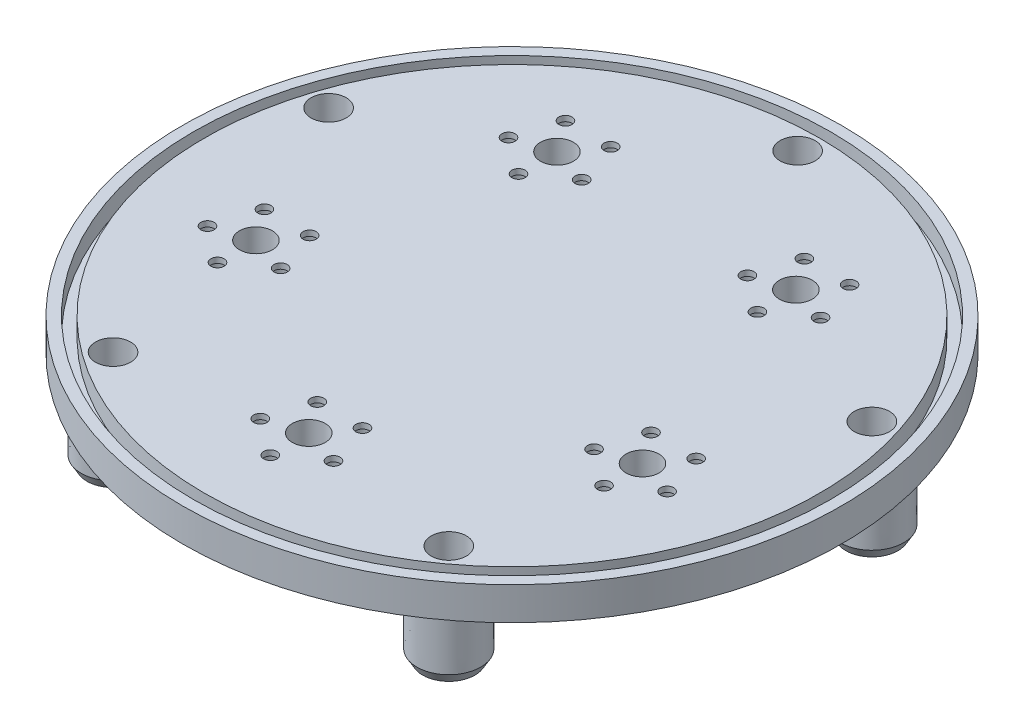
from build123d import *
from OCP.BRepFilletAPI import BRepFilletAPI_MakeChamfer

# Parameters (mm, degrees)
SKETCH1_R                     = 30
BOSS_EXTRUDE1_DEPTH           = 3
SKETCH5_R                     = 2.94
BOSS_EXTRUDE3_DEPTH           = 6
BOSS_EXTRUDE3_DRAFT           = 0.4
BOSS_EXTRUDE3_PROFILE_2_DEPTH = 6
BOSS_EXTRUDE3_PROFILE_2_DRAFT = 0.4
BOSS_EXTRUDE3_PROFILE_3_DEPTH = 6
BOSS_EXTRUDE3_PROFILE_3_DRAFT = 0.4
BOSS_EXTRUDE3_PROFILE_4_DEPTH = 6
BOSS_EXTRUDE3_PROFILE_4_DRAFT = 0.4
BOSS_EXTRUDE3_PROFILE_5_DEPTH = 6
BOSS_EXTRUDE3_PROFILE_5_DRAFT = 0.4
SKETCH6_R                     = 1.5
SKETCH6_R_2                   = 0.6
CUT_EXTRUDE2_DEPTH            = 43.848570571
SKETCH7_R                     = 1
CUT_EXTRUDE3_DEPTH            = 2.5
CUT_EXTRUDE4_DEPTH            = 1.7
SKETCH9_R                     = 1.6
CUT_EXTRUDE5_DEPTH            = 44.370496884
CHAMFER1_SIZE                 = 0.9
CHAMFER1_SIZE2                = 0.521730862
SKETCH2_R                     = 29
SKETCH2_R_2                   = 28
CUT_EXTRUDE6_DEPTH            = 1.7


with BuildPart() as part:
    # Sketch1 → Boss-Extrude1 (new body)
    with BuildSketch(Plane(origin=(0, 0, 0), x_dir=(1, 0, 0), z_dir=(0, 1, 0))):
        with Locations(Location((0, 0, 0), (0, 0, 270))):
            Circle(SKETCH1_R)
    extrude(amount=BOSS_EXTRUDE1_DEPTH)


with BuildPart() as boss_extrude3_tool:
    # Sketch5 → Boss-Extrude3 (with draft: the straight prism first)
    with BuildSketch(Plane.XZ):
        with Locations((0, -26)):
            Circle(SKETCH5_R)
    extrude(amount=BOSS_EXTRUDE3_DEPTH)
    # Boss-Extrude3: the draft: its side faces are tilted about the plane it starts from
    boss_extrude3_sides = [boss_extrude3_tool.faces().sort_by_distance(p)[0] for p in [
        (-2.94, -3, -26),
    ]]
    draft(boss_extrude3_sides, Plane.XZ, BOSS_EXTRUDE3_DRAFT)


with BuildPart() as part_1:
    add(part.part)

    # Boss-Extrude3: add boss_extrude3_tool
    add(boss_extrude3_tool.part)


with BuildPart() as boss_extrude3_profile_2_tool:
    # Sketch5 → Boss-Extrude3 profile 2 (with draft: the straight prism first)
    with BuildSketch(Plane.XZ):
        with Locations((-24.727469424, -8.034441854)):
            Circle(SKETCH5_R)
    extrude(amount=BOSS_EXTRUDE3_PROFILE_2_DEPTH)
    # Boss-Extrude3 profile 2: the draft: its side faces are tilted about the plane it starts from
    boss_extrude3_profile_2_sides = [boss_extrude3_profile_2_tool.faces().sort_by_distance(p)[0] for p in [
        (-27.667469424, -3, -8.034441854),
    ]]
    draft(boss_extrude3_profile_2_sides, Plane.XZ, BOSS_EXTRUDE3_PROFILE_2_DRAFT)


with BuildPart() as part_2:
    add(part_1.part)

    # Boss-Extrude3 profile 2: add boss_extrude3_profile_2_tool
    add(boss_extrude3_profile_2_tool.part)


with BuildPart() as boss_extrude3_profile_3_tool:
    # Sketch5 → Boss-Extrude3 profile 3 (with draft: the straight prism first)
    with BuildSketch(Plane.XZ):
        with Locations((-15.28241656, 21.034441854)):
            Circle(SKETCH5_R)
    extrude(amount=BOSS_EXTRUDE3_PROFILE_3_DEPTH)
    # Boss-Extrude3 profile 3: the draft: its side faces are tilted about the plane it starts from
    boss_extrude3_profile_3_sides = [boss_extrude3_profile_3_tool.faces().sort_by_distance(p)[0] for p in [
        (-18.22241656, -3, 21.034441854),
    ]]
    draft(boss_extrude3_profile_3_sides, Plane.XZ, BOSS_EXTRUDE3_PROFILE_3_DRAFT)


with BuildPart() as part_3:
    add(part_2.part)

    # Boss-Extrude3 profile 3: add boss_extrude3_profile_3_tool
    add(boss_extrude3_profile_3_tool.part)


with BuildPart() as boss_extrude3_profile_4_tool:
    # Sketch5 → Boss-Extrude3 profile 4 (with draft: the straight prism first)
    with BuildSketch(Plane.XZ):
        with Locations((15.28241656, 21.034441854)):
            Circle(SKETCH5_R)
    extrude(amount=BOSS_EXTRUDE3_PROFILE_4_DEPTH)
    # Boss-Extrude3 profile 4: the draft: its side faces are tilted about the plane it starts from
    boss_extrude3_profile_4_sides = [boss_extrude3_profile_4_tool.faces().sort_by_distance(p)[0] for p in [
        (12.34241656, -3, 21.034441854),
    ]]
    draft(boss_extrude3_profile_4_sides, Plane.XZ, BOSS_EXTRUDE3_PROFILE_4_DRAFT)


with BuildPart() as part_4:
    add(part_3.part)

    # Boss-Extrude3 profile 4: add boss_extrude3_profile_4_tool
    add(boss_extrude3_profile_4_tool.part)


with BuildPart() as boss_extrude3_profile_5_tool:
    # Sketch5 → Boss-Extrude3 profile 5 (with draft: the straight prism first)
    with BuildSketch(Plane.XZ):
        with Locations((24.727469424, -8.034441854)):
            Circle(SKETCH5_R)
    extrude(amount=BOSS_EXTRUDE3_PROFILE_5_DEPTH)
    # Boss-Extrude3 profile 5: the draft: its side faces are tilted about the plane it starts from
    boss_extrude3_profile_5_sides = [boss_extrude3_profile_5_tool.faces().sort_by_distance(p)[0] for p in [
        (21.787469424, -3, -8.034441854),
    ]]
    draft(boss_extrude3_profile_5_sides, Plane.XZ, BOSS_EXTRUDE3_PROFILE_5_DRAFT)


with BuildPart() as part_5:
    add(part_4.part)

    # Boss-Extrude3 profile 5: add boss_extrude3_profile_5_tool
    add(boss_extrude3_profile_5_tool.part)

    # Sketch6 → Cut-Extrude2 (cut, through all)
    with BuildSketch(Plane.XZ):
        with Locations(Location((0, 18.5, 0), (0, 0, 270))):
            Circle(SKETCH6_R)
        with Locations(Location((0, 22, 0), (0, 0, 270))):
            Circle(SKETCH6_R_2)
        with Locations(Location((3.328697807, 19.58155948, 0), (0, 0, 270))):
            Circle(SKETCH6_R_2)
        with Locations(Location((2.057248383, 15.66844052, 0), (0, 0, 270))):
            Circle(SKETCH6_R_2)
        with Locations(Location((-2.057248383, 15.66844052, 0), (0, 0, 270))):
            Circle(SKETCH6_R_2)
        with Locations(Location((-3.328697807, 19.58155948, 0), (0, 0, 270))):
            Circle(SKETCH6_R_2)
        with Locations(Location((17.594545551, 5.716814396, 0), (0, 0, 270))):
            Circle(SKETCH6_R)
        with Locations(Location((20.923243358, 6.798373876, 0), (0, 0, 270))):
            Circle(SKETCH6_R_2)
        with Locations(Location((19.651793934, 2.885254916, 0), (0, 0, 270))):
            Circle(SKETCH6_R_2)
        with Locations(Location((15.537297168, 2.885254916, 0), (0, 0, 270))):
            Circle(SKETCH6_R_2)
        with Locations(Location((14.265847744, 6.798373876, 0), (0, 0, 270))):
            Circle(SKETCH6_R_2)
        with Locations(Location((17.594545551, 9.216814396, 0), (0, 0, 270))):
            Circle(SKETCH6_R_2)
        with Locations(Location((10.874027167, -14.966814396, 0), (0, 0, 270))):
            Circle(SKETCH6_R)
        with Locations(Location((12.93127555, -17.798373876, 0), (0, 0, 270))):
            Circle(SKETCH6_R_2)
        with Locations(Location((8.816778784, -17.798373876, 0), (0, 0, 270))):
            Circle(SKETCH6_R_2)
        with Locations(Location((7.54532936, -13.885254916, 0), (0, 0, 270))):
            Circle(SKETCH6_R_2)
        with Locations(Location((10.874027167, -11.466814396, 0), (0, 0, 270))):
            Circle(SKETCH6_R_2)
        with Locations(Location((14.202724974, -13.885254916, 0), (0, 0, 270))):
            Circle(SKETCH6_R_2)
        with Locations(Location((-10.874027167, -14.966814396, 0), (0, 0, 270))):
            Circle(SKETCH6_R)
        with Locations(Location((-12.93127555, -17.798373876, 0), (0, 0, 270))):
            Circle(SKETCH6_R_2)
        with Locations(Location((-14.202724974, -13.885254916, 0), (0, 0, 270))):
            Circle(SKETCH6_R_2)
        with Locations(Location((-10.874027167, -11.466814396, 0), (0, 0, 270))):
            Circle(SKETCH6_R_2)
        with Locations(Location((-7.54532936, -13.885254916, 0), (0, 0, 270))):
            Circle(SKETCH6_R_2)
        with Locations(Location((-8.816778784, -17.798373876, 0), (0, 0, 270))):
            Circle(SKETCH6_R_2)
        with Locations(Location((-17.594545551, 5.716814396, 0), (0, 0, 270))):
            Circle(SKETCH6_R)
        with Locations(Location((-20.923243358, 6.798373876, 0), (0, 0, 270))):
            Circle(SKETCH6_R_2)
        with Locations(Location((-17.594545551, 9.216814396, 0), (0, 0, 270))):
            Circle(SKETCH6_R_2)
        with Locations(Location((-14.265847744, 6.798373876, 0), (0, 0, 270))):
            Circle(SKETCH6_R_2)
        with Locations(Location((-15.537297168, 2.885254916, 0), (0, 0, 270))):
            Circle(SKETCH6_R_2)
        with Locations(Location((-19.651793934, 2.885254916, 0), (0, 0, 270))):
            Circle(SKETCH6_R_2)
    extrude(amount=-CUT_EXTRUDE2_DEPTH, mode=Mode.SUBTRACT)

    # Sketch7 → Cut-Extrude3 (cut)
    with BuildSketch(Plane.XZ):
        with Locations(Location((0, 22, 0), (0, 0, 270))):
            Circle(SKETCH7_R)
        with Locations(Location((3.328697807, 19.58155948, 0), (0, 0, 270))):
            Circle(SKETCH7_R)
        with Locations(Location((2.057248383, 15.66844052, 0), (0, 0, 270))):
            Circle(SKETCH7_R)
        with Locations(Location((-2.057248383, 15.66844052, 0), (0, 0, 270))):
            Circle(SKETCH7_R)
        with Locations(Location((-3.328697807, 19.58155948, 0), (0, 0, 270))):
            Circle(SKETCH7_R)
        with Locations(Location((20.923243358, 6.798373876, 0), (0, 0, 270))):
            Circle(SKETCH7_R)
        with Locations(Location((19.651793934, 2.885254916, 0), (0, 0, 270))):
            Circle(SKETCH7_R)
        with Locations(Location((15.537297168, 2.885254916, 0), (0, 0, 270))):
            Circle(SKETCH7_R)
        with Locations(Location((14.265847744, 6.798373876, 0), (0, 0, 270))):
            Circle(SKETCH7_R)
        with Locations(Location((17.594545551, 9.216814396, 0), (0, 0, 270))):
            Circle(SKETCH7_R)
        with Locations(Location((12.93127555, -17.798373876, 0), (0, 0, 270))):
            Circle(SKETCH7_R)
        with Locations(Location((8.816778784, -17.798373876, 0), (0, 0, 270))):
            Circle(SKETCH7_R)
        with Locations(Location((7.54532936, -13.885254916, 0), (0, 0, 270))):
            Circle(SKETCH7_R)
        with Locations(Location((10.874027167, -11.466814396, 0), (0, 0, 270))):
            Circle(SKETCH7_R)
        with Locations(Location((14.202724974, -13.885254916, 0), (0, 0, 270))):
            Circle(SKETCH7_R)
        with Locations(Location((-12.93127555, -17.798373876, 0), (0, 0, 270))):
            Circle(SKETCH7_R)
        with Locations(Location((-14.202724974, -13.885254916, 0), (0, 0, 270))):
            Circle(SKETCH7_R)
        with Locations(Location((-10.874027167, -11.466814396, 0), (0, 0, 270))):
            Circle(SKETCH7_R)
        with Locations(Location((-7.54532936, -13.885254916, 0), (0, 0, 270))):
            Circle(SKETCH7_R)
        with Locations(Location((-8.816778784, -17.798373876, 0), (0, 0, 270))):
            Circle(SKETCH7_R)
        with Locations(Location((-20.923243358, 6.798373876, 0), (0, 0, 270))):
            Circle(SKETCH7_R)
        with Locations(Location((-17.594545551, 9.216814396, 0), (0, 0, 270))):
            Circle(SKETCH7_R)
        with Locations(Location((-14.265847744, 6.798373876, 0), (0, 0, 270))):
            Circle(SKETCH7_R)
        with Locations(Location((-15.537297168, 2.885254916, 0), (0, 0, 270))):
            Circle(SKETCH7_R)
        with Locations(Location((-19.651793934, 2.885254916, 0), (0, 0, 270))):
            Circle(SKETCH7_R)
    extrude(amount=-CUT_EXTRUDE3_DEPTH, mode=Mode.SUBTRACT)

    # Sketch8 → Cut-Extrude4 (cut)
    with BuildSketch(Plane.XZ):
        with BuildLine():
            Line((-11.176474067, 8.552516868), (-2.952204928, 7.294026843))
            ThreePointArc((-2.952204928, 7.294026843), (-1.235877142, 4.957529694), (-3.572374291, 3.241201907))
            Line((-3.572374291, 3.241201907), (-11.79664343, 4.499691932))
            Line((-11.79664343, 4.499691932), (-11.547063076, 6.130706845))
            Line((-11.547063076, 6.130706845), (-3.322793938, 4.872216821))
            ThreePointArc((-3.322793938, 4.872216821), (-2.866892055, 5.207110047), (-3.201785282, 5.66301193))
            Line((-3.201785282, 5.66301193), (-11.42605442, 6.921501955))
            Line((-11.42605442, 6.921501955), (-11.176474067, 8.552516868))
        make_face()
        with BuildLine():
            Line((1.978641828, 4.39911632), (0.634098037, 12.609755881))
            Line((0.634098037, 12.609755881), (2.262409969, 12.876402185))
            Line((2.262409969, 12.876402185), (3.60695376, 4.665762625))
            ThreePointArc((3.60695376, 4.665762625), (4.066337575, 4.335661867), (4.396438334, 4.795045682))
            Line((4.396438334, 4.795045682), (3.051894542, 13.005685242))
            Line((3.051894542, 13.005685242), (4.680206474, 13.272331547))
            Line((4.680206474, 13.272331547), (6.024750266, 5.061691987))
            ThreePointArc((6.024750266, 5.061691987), (4.33298388, 2.707349935), (1.978641828, 4.39911632))
        make_face()
        with BuildLine():
            Line((4.795242193, -0.522398501), (12.188537569, 3.293565792))
            Line((12.188537569, 3.293565792), (12.945309333, 1.827347358))
            Line((12.945309333, 1.827347358), (5.552013958, -1.988616935))
            ThreePointArc((5.552013958, -1.988616935), (5.380026887, -2.52752365), (5.918933601, -2.699510721))
            Line((5.918933601, -2.699510721), (13.312228977, 1.116453572))
            Line((13.312228977, 1.116453572), (14.069000742, -0.349764862))
            Line((14.069000742, -0.349764862), (6.675705366, -4.165729155))
            ThreePointArc((6.675705366, -4.165729155), (3.913808453, -3.284295415), (4.795242193, -0.522398501))
        make_face()
        with BuildLine():
            Line((0.984980831, -4.721976349), (6.898832454, -10.574220277))
            Line((6.898832454, -10.574220277), (5.738231194, -11.747039409))
            Line((5.738231194, -11.747039409), (-0.175620428, -5.894795481))
            ThreePointArc((-0.175620428, -5.894795481), (-0.741298099, -5.89775739), (-0.738336191, -6.46343506))
            Line((-0.738336191, -6.46343506), (5.175515432, -12.315678988))
            Line((5.175515432, -12.315678988), (4.014914172, -13.48849812))
            Line((4.014914172, -13.48849812), (-1.89893745, -7.636254192))
            ThreePointArc((-1.89893745, -7.636254192), (-1.914117231, -4.73715613), (0.984980831, -4.721976349))
        make_face()
        with BuildLine():
            Line((-4.186490561, -2.395943377), (-7.924824629, -9.828793328))
            Line((-7.924824629, -9.828793328), (-9.39888742, -9.08741698))
            Line((-9.39888742, -9.08741698), (-5.660553352, -1.654567029))
            ThreePointArc((-5.660553352, -1.654567029), (-5.838174308, -1.117490874), (-6.375250462, -1.29511183))
            Line((-6.375250462, -1.29511183), (-10.113584531, -8.727961781))
            Line((-10.113584531, -8.727961781), (-11.587647322, -7.986585433))
            Line((-11.587647322, -7.986585433), (-7.849313253, -0.553735483))
            ThreePointArc((-7.849313253, -0.553735483), (-5.09679796, 0.356571916), (-4.186490561, -2.395943377))
        make_face()
    extrude(amount=-CUT_EXTRUDE4_DEPTH, mode=Mode.SUBTRACT)

    # Sketch9 → Cut-Extrude5 (cut, through all)
    with BuildSketch(Plane.XZ.offset(6)):
        with Locations(Location((-24.727469424, -8.034441854, 0), (0, 0, 270))):
            Circle(SKETCH9_R)
        with Locations(Location((-15.28241656, 21.034441854, 0), (0, 0, 270))):
            Circle(SKETCH9_R)
        with Locations(Location((15.28241656, 21.034441854, 0), (0, 0, 270))):
            Circle(SKETCH9_R)
        with Locations(Location((24.727469424, -8.034441854, 0), (0, 0, 270))):
            Circle(SKETCH9_R)
        with Locations(Location((0, -26, 0), (0, 0, 270))):
            Circle(SKETCH9_R)
    extrude(amount=-CUT_EXTRUDE5_DEPTH, mode=Mode.SUBTRACT)

    # Chamfer1: one chamfer whose edges measure the first distance from different faces: ONE call of the kernel's chamfer builder (chamfer() names one face for all edges)
    chamfer1_edges_1 = [part_5.edges().sort_by_distance(p)[0] for p in [
        (-18.180527977, -6, 21.034441854),
    ]]
    chamfer1_side_1 = [part_5.faces().sort_by_distance(p)[0] for p in [
        (-18.201472268, -3, 21.034441854),
    ]]
    chamfer1_edges_2 = [part_5.edges().sort_by_distance(p)[0] for p in [
        (12.384305142, -6, 21.034441854),
    ]]
    chamfer1_side_2 = [part_5.faces().sort_by_distance(p)[0] for p in [
        (12.363360851, -3, 21.034441854),
    ]]
    chamfer1_edges_3 = [part_5.edges().sort_by_distance(p)[0] for p in [
        (21.829358006, -6, -8.034441854),
    ]]
    chamfer1_side_3 = [part_5.faces().sort_by_distance(p)[0] for p in [
        (21.808413715, -3, -8.034441854),
    ]]
    chamfer1_edges_4 = [part_5.edges().sort_by_distance(p)[0] for p in [
        (-2.898111417, -6, -26),
    ]]
    chamfer1_side_4 = [part_5.faces().sort_by_distance(p)[0] for p in [
        (-2.919055709, -3, -26),
    ]]
    chamfer1_edges_5 = [part_5.edges().sort_by_distance(p)[0] for p in [
        (-27.625580841, -6, -8.034441854),
    ]]
    chamfer1_side_5 = [part_5.faces().sort_by_distance(p)[0] for p in [
        (-27.646525132, -3, -8.034441854),
    ]]
    chamfer1 = BRepFilletAPI_MakeChamfer(part_5.part.solid().wrapped)
    for e in chamfer1_edges_1:
        chamfer1.Add(CHAMFER1_SIZE, CHAMFER1_SIZE2, e.wrapped, chamfer1_side_1[0].wrapped)  # the first distance lies on this face
    for e in chamfer1_edges_2:
        chamfer1.Add(CHAMFER1_SIZE, CHAMFER1_SIZE2, e.wrapped, chamfer1_side_2[0].wrapped)  # the first distance lies on this face
    for e in chamfer1_edges_3:
        chamfer1.Add(CHAMFER1_SIZE, CHAMFER1_SIZE2, e.wrapped, chamfer1_side_3[0].wrapped)  # the first distance lies on this face
    for e in chamfer1_edges_4:
        chamfer1.Add(CHAMFER1_SIZE, CHAMFER1_SIZE2, e.wrapped, chamfer1_side_4[0].wrapped)  # the first distance lies on this face
    for e in chamfer1_edges_5:
        chamfer1.Add(CHAMFER1_SIZE, CHAMFER1_SIZE2, e.wrapped, chamfer1_side_5[0].wrapped)  # the first distance lies on this face
    add(Compound.cast(chamfer1.Shape()), mode=Mode.REPLACE)

    # Sketch2 → Cut-Extrude6 (cut)
    with BuildSketch(Plane.XZ.offset(-3)):
        with Locations(Location((0, 0, 0), (0, 0, 270))):
            Circle(SKETCH2_R)
        with Locations(Location((0, 0, 0), (0, 0, 270))):
            Circle(SKETCH2_R_2, mode=Mode.SUBTRACT)
    extrude(amount=CUT_EXTRUDE6_DEPTH, mode=Mode.SUBTRACT)


solid = part_5.part
